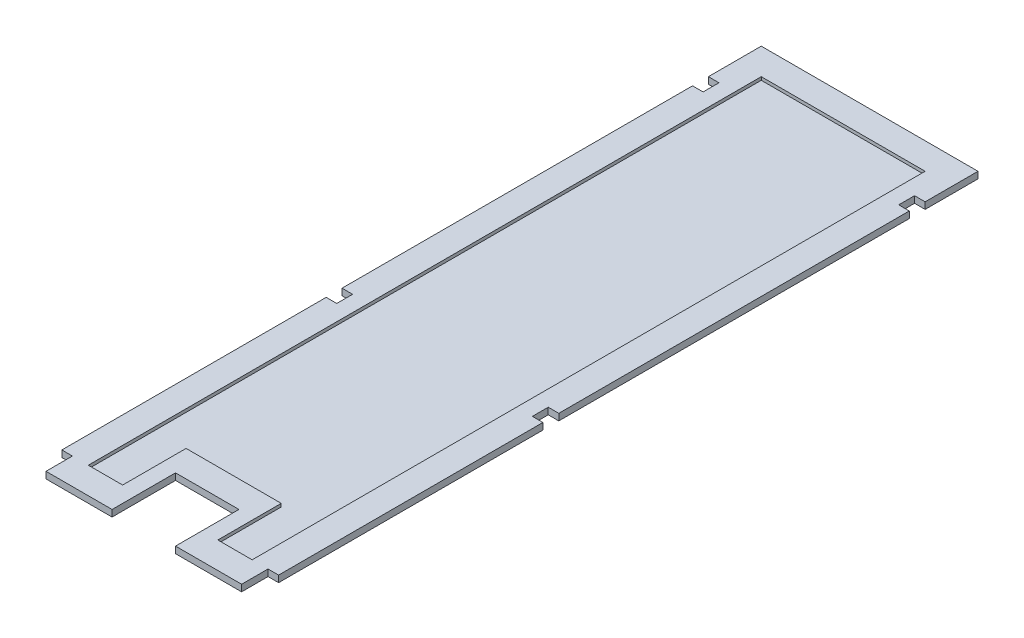
from build123d import *

# Parameters (mm, degrees)
BOSS_EXTRUDE1_DEPTH = 1.25
CUT_EXTRUDE1_DEPTH  = 0.6


with BuildPart() as part:
    # Sketch1 → Boss-Extrude1 (new body)
    with BuildSketch(Plane(origin=(0, 0, 0), x_dir=(1, 0, 0), z_dir=(0, 1, 0))):
        Polygon((0, 58), (0, 124.3), (2, 124.3), (2, 127.3), (0, 127.3), (0, 137.3), (41, 137.3), (41, 127.3), (39, 127.3), (39, 124.3), (41, 124.3), (41, 58), (39, 58), (39, 55), (41, 55), (41, 5), (39, 5), (39, 0), (26.5, 0), (26.5, 12), (14.5, 12), (14.5, 0), (2, 0), (2, 5), (0, 5), (0, 55), (2, 55), (2, 58), align=None)
    extrude(amount=BOSS_EXTRUDE1_DEPTH)

    # Sketch2 → Cut-Extrude1 (cut)
    with BuildSketch(Plane(origin=(0, 1.25, 0), x_dir=(1, 0, 0), z_dir=(0, 1, 0))):
        Polygon((5, 132.3), (36, 132.3), (36, 17), (36, 5), (29.5, 5), (29.5, 17), (11.5, 17), (11.5, 5), (5, 5), (5, 17), align=None)
    extrude(amount=-CUT_EXTRUDE1_DEPTH, mode=Mode.SUBTRACT)


solid = part.part
